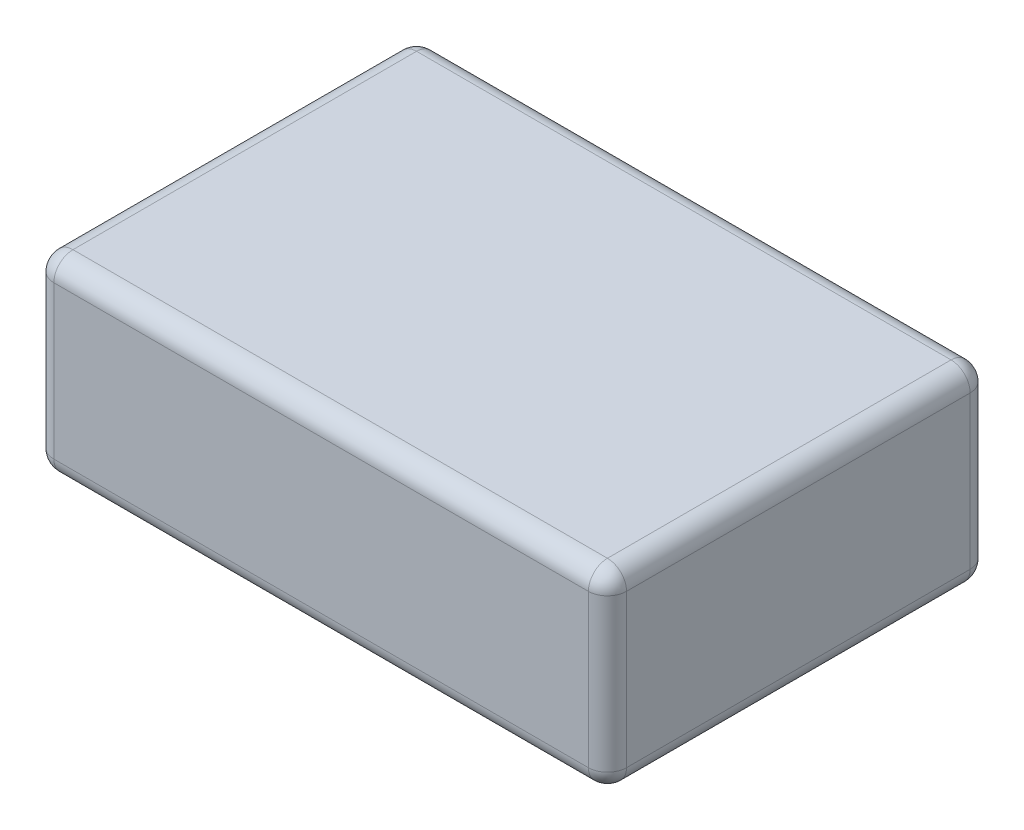
from build123d import *

# Parameters (mm, degrees)
SKETCH1_W           = 20
SKETCH1_H           = 10
BOSS_EXTRUDE1_DEPTH = 15
FILLET1_R           = 1


with BuildPart() as part:
    # Sketch1 → Boss-Extrude1 (new, symmetric)
    with BuildSketch(Plane(origin=(0, 0, 0), x_dir=(0, 0, -1), z_dir=(1, 0, 0))):
        Rectangle(SKETCH1_W, SKETCH1_H)
    extrude(amount=BOSS_EXTRUDE1_DEPTH, both=True)

    # Fillet1
    fillet1_edges = [part.edges().sort_by_distance(p)[0] for p in [
        (15, 0, 10),
        (15, -5, 0),
        (15, 0, -10),
        (-15, -5, 0),
        (-15, 0, 10),
        (-15, 5, 0),
        (-15, 0, -10),
        (0, -5, -10),
        (0, -5, 10),
        (0, 5, 10),
        (0, 5, -10),
        (15, 5, 0),
    ]]
    fillet(fillet1_edges, radius=FILLET1_R)


solid = part.part
